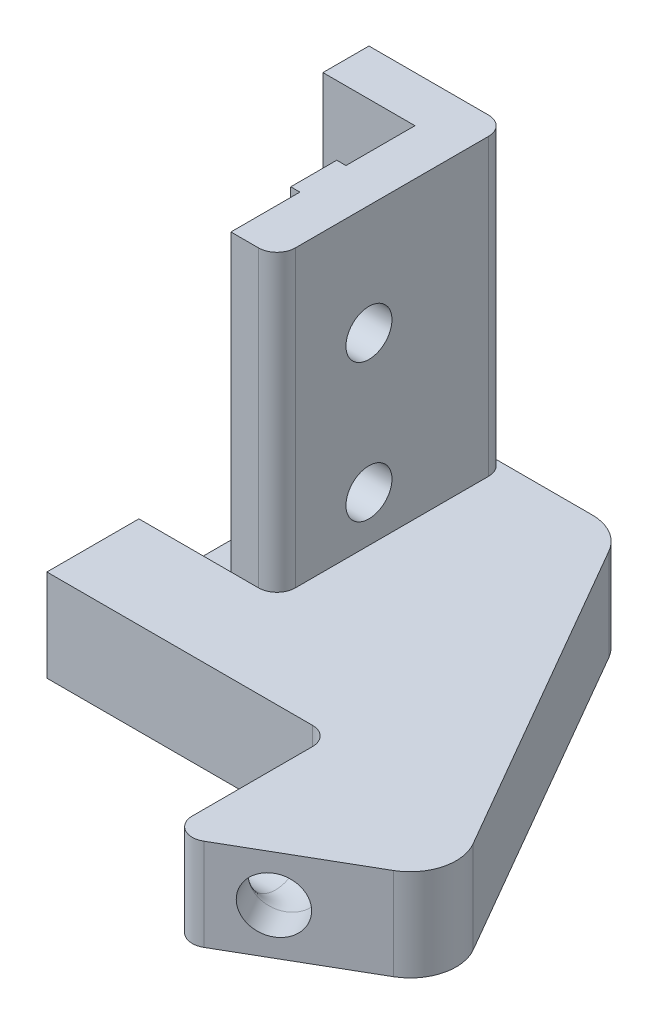
from build123d import *

# Parameters (mm, degrees)
SKETCH1_W                = 20
SKETCH1_H                = 20.000000000000014
BOSS_EXTRUDE1_DEPTH      = 10
SKETCH2_R                = 3.000000000000015
CUT_EXTRUDE1_DEPTH       = 120.06125706799004
BOSS_EXTRUDE2_DEPTH      = 32
BOSS_EXTRUDE2_DEPTH_BACK = 10
SKETCH7_R                = 2.4999999999999956
CUT_EXTRUDE3_DEPTH       = 20
SKETCH8_W                = 10
SKETCH8_H                = 20.000000000000014
BOSS_EXTRUDE4_DEPTH      = 3
BOSS_EXTRUDE5_DEPTH      = 1
FILLET1_R                = 0.25
FILLET3_R                = 2
FILLET4_R                = 5


with BuildPart() as part:
    # Sketch1 → Boss-Extrude1 (new body)
    with BuildSketch(Plane(origin=(0, 0, 0), x_dir=(1, 0, 0), z_dir=(0, 1, 0))):
        Polygon((-51.25019936166113, 65.23205080756885), (-46.92007234273894, 62.732050807568854), (-30.867513459481355, 53.46410161513777), (-30.867513459481355, 72), (30.867513459481284, 72), (30.867513459481284, 53.46410161513781), (46.92007234273889, 62.73205080756891), (51.25019936166109, 65.23205080756892), (27.13546265191245, 106.99999999999991), (-27.135462651912732, 106.99999999999991), align=None)
        with Locations((0, 91.99999999999991)):
            Rectangle(SKETCH1_W, SKETCH1_H, mode=Mode.SUBTRACT)
    extrude(amount=BOSS_EXTRUDE1_DEPTH)

    # Cut-Sweep1: sweep along a path in Sketch3
    with BuildLine(Plane(origin=(0, 5, 0), x_dir=(1, 0, 0), z_dir=(0, 1, 0))) as cut_sweep1_path:
        Line((-30.867513459481355, 62.499999999999986), (-34.35234101678278, 62.499999999999986))
        ThreePointArc((-34.35234101678278, 62.499999999999986), (-35.85234101678278, 62.0980762113533), (-36.9504172281361, 60.999999999999986))
        Line((-36.9504172281361, 60.999999999999986), (-38.69283100678681, 57.98205080756888))
    # Sketch2 → Cut-Sweep1 (sweep, cut)
    with BuildSketch(Plane(origin=(-30.867513459481355, 0, 0), x_dir=(0, 0, -1), z_dir=(1, 0, 0))):
        with Locations((62.49999999999999, 5)):
            Circle(SKETCH2_R)
    cut_sweep1 = sweep(path=cut_sweep1_path.line, mode=Mode.SUBTRACT)

    # Mirror3: Cut-Sweep1 across plane
    add(cut_sweep1.mirror(Plane(origin=(0, 0, 0), x_dir=(0, 0, 1), z_dir=(1, 0, 0))), mode=Mode.SUBTRACT)

    # Sketch4 → Cut-Extrude1 (cut, through all)
    with BuildSketch(Plane(origin=(0, 0, 0), x_dir=(0, 0, -1), z_dir=(1, 0, 0))):
        Polygon((65.23205080756894, 0), (106.99999999999991, 0), (106.99999999999991, 10), (65.23205080756894, 10), (53.46410161513781, 10), (53.46410161513781, 0), align=None)
    extrude(amount=-CUT_EXTRUDE1_DEPTH, mode=Mode.SUBTRACT)

    # Sketch5 → Boss-Extrude2 (add, two sides: drawn at the far end of the back side and taken through both)
    with BuildSketch(Plane(origin=(0, 10, 0), x_dir=(1, 0, 0), z_dir=(0, 1, 0)).offset(-BOSS_EXTRUDE2_DEPTH_BACK)):
        Polygon((10, 81.99999999999991), (10, 101.99999999999993), (0, 101.99999999999993), (0, 106.99999999999991), (14.999999999999993, 106.99999999999991), (14.999999999999996, 81.99999999999991), align=None)
    extrude(amount=BOSS_EXTRUDE2_DEPTH + BOSS_EXTRUDE2_DEPTH_BACK)

    # Sketch7 → Cut-Extrude3 (cut)
    with BuildSketch(Plane(origin=(10, 0, 0), x_dir=(0, 0, -1), z_dir=(1, 0, 0))):
        with Locations((91.99999999999991, 15)):
            Circle(SKETCH7_R)
        with Locations((91.99999999999991, 30)):
            Circle(SKETCH7_R)
    extrude(amount=CUT_EXTRUDE3_DEPTH, mode=Mode.SUBTRACT)

    # Sketch8 → Boss-Extrude4 (add)
    with BuildSketch(Plane.XZ):
        with Locations((5, -91.99999999999991)):
            Rectangle(SKETCH8_W, SKETCH8_H)
    extrude(amount=-BOSS_EXTRUDE4_DEPTH)

    # Sketch9 → Boss-Extrude5 (add)
    with BuildSketch(Plane.ZY.offset(-10)):
        with BuildLine():
            Line((-94.49999999999991, 3), (-94.49999999999991, 12.550510257216839))
            ThreePointArc((-94.49999999999991, 12.550510257216839), (-91.99999999999991, 11.500000000000012), (-89.49999999999991, 12.550510257216839))
            Line((-89.49999999999991, 12.550510257216839), (-89.49999999999991, 3.000000000000001))
            Line((-89.49999999999991, 3.000000000000001), (-94.49999999999991, 3))
        make_face()
        with BuildLine():
            Line((-89.49999999999993, 42), (-94.49999999999991, 42))
            Line((-94.49999999999991, 42), (-94.49999999999991, 32.44948974278316))
            ThreePointArc((-94.49999999999991, 32.44948974278316), (-91.99999999999991, 33.499999999999986), (-89.49999999999991, 32.44948974278316))
            Line((-89.49999999999991, 32.44948974278316), (-89.49999999999993, 42))
        make_face()
        with BuildLine():
            Line((-94.49999999999991, 17.44948974278316), (-94.49999999999991, 27.55051025721684))
            ThreePointArc((-94.49999999999991, 27.55051025721684), (-91.9999999999999, 26.50000000000001), (-89.4999999999999, 27.550510257216853))
            Line((-89.4999999999999, 27.550510257216853), (-89.49999999999991, 17.44948974278316))
            ThreePointArc((-89.49999999999991, 17.44948974278316), (-91.99999999999991, 18.49999999999999), (-94.49999999999991, 17.44948974278316))
        make_face()
    extrude(amount=BOSS_EXTRUDE5_DEPTH)

    # Fillet1
    fillet1_edges = [part.edges().sort_by_distance(p)[0] for p in [
        (9.5, 12.550510257216839, -89.49999999999991),
        (9.5, 12.550510257216839, -94.49999999999991),
        (9.5, 32.44948974278316, -94.49999999999991),
        (9.5, 32.44948974278316, -89.49999999999991),
        (9.5, 27.550510257216853, -89.4999999999999),
        (9.5, 27.55051025721684, -94.49999999999991),
        (9.5, 17.44948974278316, -94.49999999999991),
        (9.5, 17.44948974278316, -89.49999999999991),
    ]]
    fillet(fillet1_edges, radius=FILLET1_R)

    # Fillet3
    fillet3_edges = [part.edges().sort_by_distance(p)[0] for p in [
        (14.999999999999996, 26, -81.99999999999991),
        (14.999999999999993, 26, -106.99999999999991),
        (30.867513459481284, 5, -53.46410161513781),
        (30.867513459481284, 5, -72),
    ]]
    fillet(fillet3_edges, radius=FILLET3_R)

    # Fillet4
    fillet4_edges = [part.edges().sort_by_distance(p)[0] for p in [
        (27.135462651912448, 5, -106.99999999999991),
        (51.2501993616611, 5, -65.23205080756894),
    ]]
    fillet(fillet4_edges, radius=FILLET4_R)


solid = part.part
